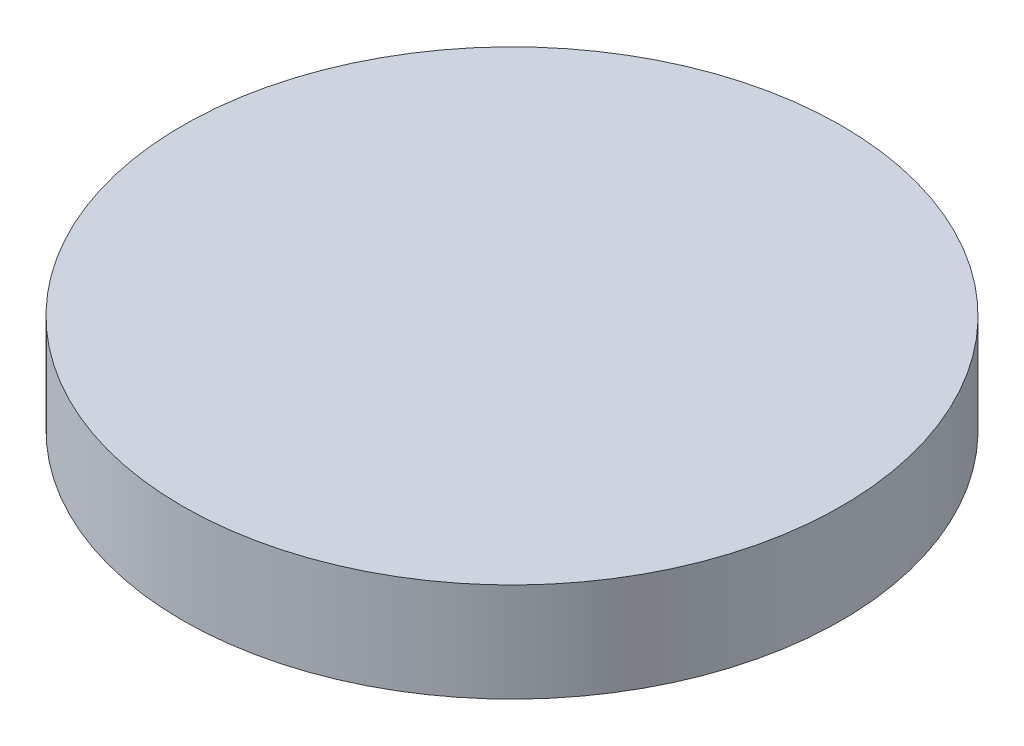
from build123d import *

# Parameters (mm, degrees)
SKETCH_1_R    = 5
F_1_5MM_DEPTH = 1.5


with BuildPart() as part:
    # 草图1 → 1.5mm 镜片 (new body)
    with BuildSketch(Plane(origin=(0, 0, 0), x_dir=(1, 0, 0), z_dir=(0, 1, 0))):
        with Locations(Location((0, 0, 0), (0, 0, 270))):
            Circle(SKETCH_1_R)
    extrude(amount=F_1_5MM_DEPTH)


solid = part.part
